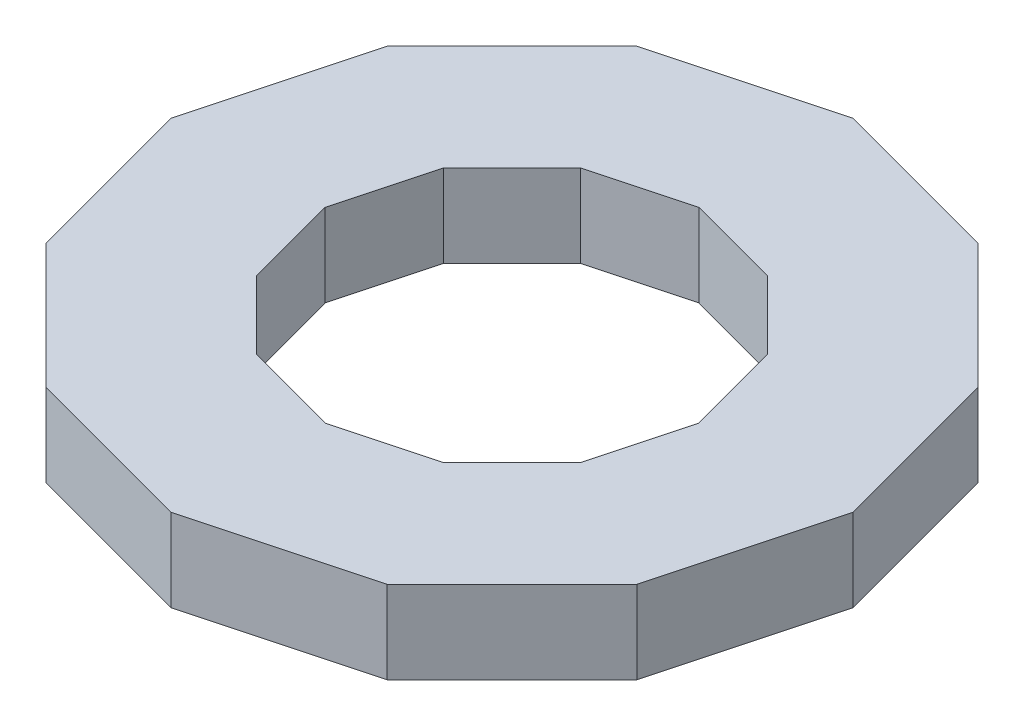
from build123d import *

# Parameters (mm, degrees)
BOSS_EXTRUDE1_DEPTH = 19.05


with BuildPart() as part:
    # Sketch1 → Boss-Extrude1 (new body)
    with BuildSketch(Plane(origin=(0, 0, 0), x_dir=(1, 0, 0), z_dir=(0, 1, 0))):
        Polygon((78.510451161, 0), (67.992045168, 39.25522558), (39.25522558, 67.992045168), (0, 78.510451161), (-39.25522558, 67.992045168), (-67.992045168, 39.25522558), (-78.510451161, 0), (-67.992045168, -39.25522558), (-39.25522558, -67.992045168), (0, -78.510451161), (39.25522558, -67.992045168), (67.992045168, -39.25522558), align=None)
        Polygon((43.010830935, 0), (37.248472227, 21.505415467), (21.505415467, 37.248472227), (0, 43.010830935), (-21.505415467, 37.248472227), (-37.248472227, 21.505415467), (-43.010830935, 0), (-37.248472227, -21.505415467), (-21.505415467, -37.248472227), (0, -43.010830935), (21.505415467, -37.248472227), (37.248472227, -21.505415467), align=None, mode=Mode.SUBTRACT)
    extrude(amount=BOSS_EXTRUDE1_DEPTH)


solid = part.part
